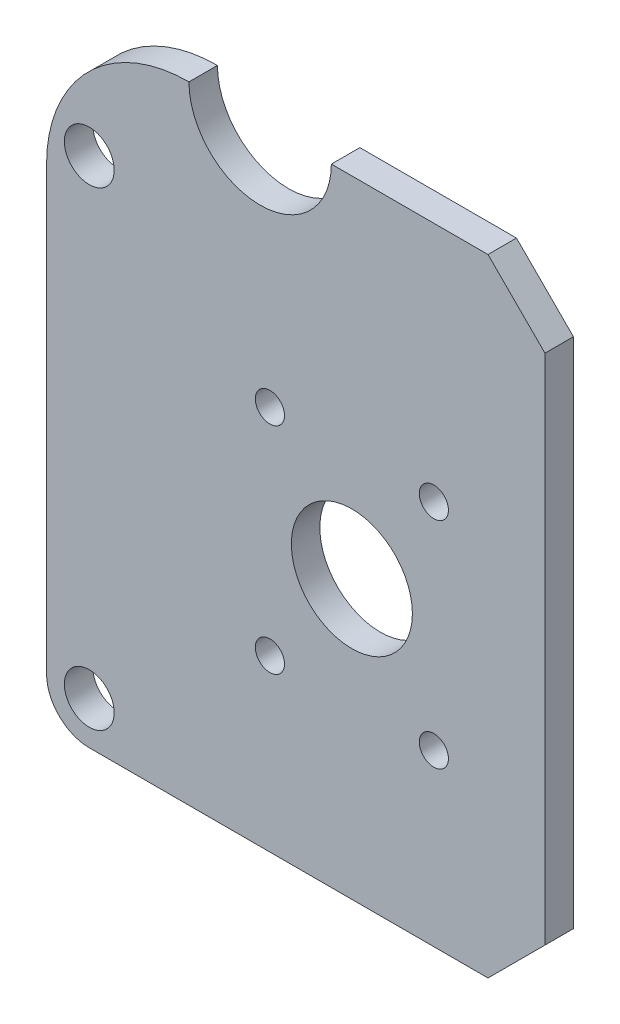
from build123d import *

# Parameters (mm, degrees)
SKETCH_2_W              = 37
SKETCH_2_H              = 39
EXTRUDE_1_DEPTH         = 2
SKETCH_3_R              = 1.75
CUT_EXTRUDE_2_DEPTH     = 2
CHAMFER_3_SIZE          = 1
SKETCH_7_R              = 4.25
CUT_EXTRUDE_3_DEPTH     = 10
SKETCH_8_W              = 2
SKETCH_8_H              = 39
CUT_EXTRUDE_4_DEPTH     = 10
FILLET_3_R              = 3
M2_5_TAPPED_HOLE1_D     = 2.05
M2_5_TAPPED_HOLE1_DEPTH = 7.25
M2_5_TAPPED_HOLE1_TIP   = 0.615882135
CHAMFER2_SIZE           = 4
SKETCH_9_W              = 35
SKETCH_9_H              = 2
EXTRUDE_1_2_DEPTH       = 5
CHAMFER_5_SIZE          = 4
FILLET_4_R              = 10
SKETCH_11_R             = 5
CUT_EXTRUDE_1_DEPTH     = 31.765240126


with BuildPart() as part:
    # 草图2 → Extrude 1 (new body)
    with BuildSketch(Plane.XY):
        Rectangle(SKETCH_2_W, SKETCH_2_H)
    extrude(amount=EXTRUDE_1_DEPTH)

    # 草图3 → 拉伸2 (cut)
    with BuildSketch(Plane.XY.offset(2)):
        with Locations((-13.5, 16.5)):
            Circle(SKETCH_3_R)
        with Locations((-13.5, -16.5)):
            Circle(SKETCH_3_R)
    extrude(amount=-CUT_EXTRUDE_2_DEPTH, mode=Mode.SUBTRACT)

    # 倒角3
    chamfer_3_edges = [part.edges().sort_by_distance(p)[0] for p in [
        (-18.5, 19.5, 1),
        (-18.5, -19.5, 1),
    ]]
    chamfer(chamfer_3_edges, length=CHAMFER_3_SIZE)

    # 草图7 → 拉伸3 (cut)
    with BuildSketch(Plane.XY.offset(2)):
        with Locations((4.94, 0)):
            Circle(SKETCH_7_R)
    extrude(amount=-CUT_EXTRUDE_3_DEPTH, mode=Mode.SUBTRACT)

    # 草图8 → 拉伸4 (cut)
    with BuildSketch(Plane.XY.offset(2)):
        with Locations((-17.5, 0)):
            Rectangle(SKETCH_8_W, SKETCH_8_H)
    extrude(amount=-CUT_EXTRUDE_4_DEPTH, mode=Mode.SUBTRACT)

    # 圆角3
    fillet_3_edges = [part.edges().sort_by_distance(p)[0] for p in [
        (-16.5, -19.5, 1),
    ]]
    fillet(fillet_3_edges, radius=FILLET_3_R)

    # M2.5 Tapped Hole1
    with Locations(Plane(origin=(-0.816889803, -7.556998068, 2), x_dir=(1, 0, 0), z_dir=(0, 0, 1))):
        with Locations((0, 0), (11.513779606, 15.113996136), (0, 15.113996136), (11.513779606, 0)):
            Hole(M2_5_TAPPED_HOLE1_D / 2, depth=M2_5_TAPPED_HOLE1_DEPTH)
            with Locations((0, 0, -(M2_5_TAPPED_HOLE1_DEPTH + M2_5_TAPPED_HOLE1_TIP / 2))):  # 118° drill point
                Cone(0, M2_5_TAPPED_HOLE1_D / 2, M2_5_TAPPED_HOLE1_TIP, mode=Mode.SUBTRACT)

    # Chamfer2
    chamfer2_edges = [part.edges().sort_by_distance(p)[0] for p in [
        (18.5, -19.5, 1),
    ]]
    chamfer(chamfer2_edges, length=CHAMFER2_SIZE)

    # 草图9 → Extrude 1 2 (add)
    with BuildSketch(Plane(origin=(0, 19.5, 0), x_dir=(1, 0, 0), z_dir=(0, 1, 0))):
        with Locations((1, -1)):
            Rectangle(SKETCH_9_W, SKETCH_9_H)
    extrude(amount=EXTRUDE_1_2_DEPTH)

    # 倒角5
    chamfer_5_edges = [part.edges().sort_by_distance(p)[0] for p in [
        (18.5, 24.5, 1),
    ]]
    chamfer(chamfer_5_edges, length=CHAMFER_5_SIZE)

    # 圆角4
    fillet_4_edges = [part.edges().sort_by_distance(p)[0] for p in [
        (-16.5, 24.5, 1),
    ]]
    fillet(fillet_4_edges, radius=FILLET_4_R)

    # 草图11 → 切除-拉伸1 (cut, through all)
    with BuildSketch(Plane.XY.offset(2)):
        with Locations((-1.5, 24.5)):
            Circle(SKETCH_11_R)
    extrude(amount=-CUT_EXTRUDE_1_DEPTH, mode=Mode.SUBTRACT)


solid = part.part
